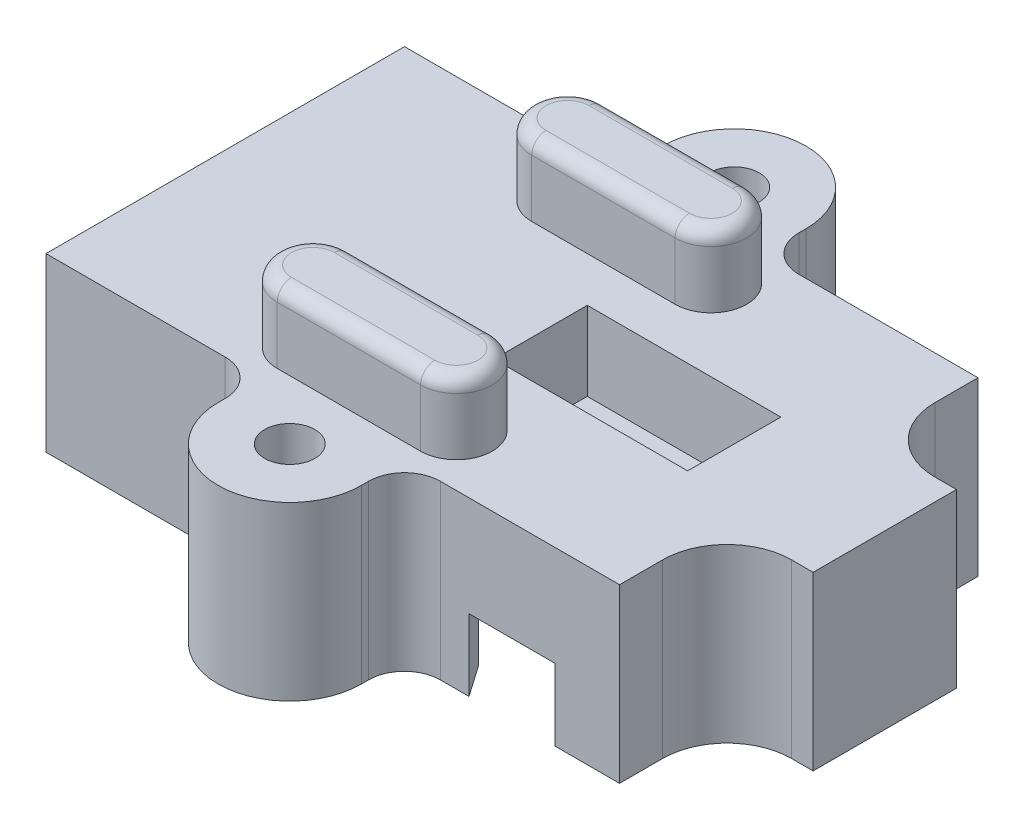
from build123d import *

# Parameters (mm, degrees)
SKETCH2_R           = 1.75
SKETCH2_W           = 13.5
SKETCH2_H           = 3.5
BOSS_EXTRUDE2_DEPTH = 12
BOSS_EXTRUDE3_START = 7
SKETCH2_4_R         = 1.75
SKETCH2_4_W         = 13.5
SKETCH2_4_H         = 6.5
SKETCH2_4_H_2       = 3.5
BOSS_EXTRUDE3_DEPTH = 5
CUT_EXTRUDE1_START  = 12
SKETCH2_6_W         = 13.5
SKETCH2_6_H         = 1.5
CUT_EXTRUDE1_DEPTH  = 5.5
FILLET1_R           = 4.5
CUT_EXTRUDE4_DEPTH  = 5
BOSS_EXTRUDE4_DEPTH = 5
FILLET2_R           = 1


with BuildPart() as part:
    # Sketch2 → Boss-Extrude2 (new body)
    with BuildSketch(Plane(origin=(0, 0, 0), x_dir=(1, 0, 0), z_dir=(0, 1, 0))):
        with BuildLine():
            Line((-20, 12.5), (-20, -12.5))
            Line((-20, -12.5), (-7.5, -12.5))
            ThreePointArc((-7.5, -12.5), (-5.732233047, -13.232233047), (-5, -15))
            Line((-5, -15), (-5, -15.5))
            ThreePointArc((-5, -15.5), (0, -20.5), (5, -15.5))
            Line((5, -15.5), (5, -15))
            ThreePointArc((5, -15), (5.732233047, -13.232233047), (7.5, -12.5))
            Line((7.5, -12.5), (20, -12.5))
            Line((20, -12.5), (20, -5))
            Line((20, -5), (26, -5))
            Line((26, -5), (26, 5))
            Line((26, 5), (20, 5))
            Line((20, 5), (20, 12.5))
            Line((20, 12.5), (7.5, 12.5))
            ThreePointArc((7.5, 12.5), (5.732233047, 13.232233047), (5, 15))
            Line((5, 15), (5, 15.5))
            ThreePointArc((5, 15.5), (0, 20.5), (-5, 15.5))
            Line((-5, 15.5), (-5, 15))
            ThreePointArc((-5, 15), (-5.732233047, 13.232233047), (-7.5, 12.5))
            Line((-7.5, 12.5), (-20, 12.5))
        make_face()
        with Locations(Location((0, -15.5, 0), (0, 0, 270))):
            Circle(SKETCH2_R, mode=Mode.SUBTRACT)
        with Locations(Location((0, 15.5, 0), (0, 0, 270))):
            Circle(SKETCH2_R, mode=Mode.SUBTRACT)
        with Locations((8.75, 0)):
            Rectangle(SKETCH2_W, SKETCH2_H, mode=Mode.SUBTRACT)
    extrude(amount=BOSS_EXTRUDE2_DEPTH)

    # Sketch2<4> → Boss-Extrude3 (add)
    with BuildSketch(Plane(origin=(0, 0, 0), x_dir=(1, 0, 0), z_dir=(0, 1, 0)).offset(BOSS_EXTRUDE3_START)):
        with BuildLine():
            Line((-20, -12.5), (-7.5, -12.5))
            ThreePointArc((-7.5, -12.5), (-5.732233047, -13.232233047), (-5, -15))
            Line((-5, -15), (-5, -15.5))
            ThreePointArc((-5, -15.5), (0, -20.5), (5, -15.5))
            Line((5, -15.5), (5, -15))
            ThreePointArc((5, -15), (5.732233047, -13.232233047), (7.5, -12.5))
            Line((7.5, -12.5), (20, -12.5))
            Line((20, -12.5), (20, -5))
            Line((20, -5), (26, -5))
            Line((26, -5), (26, 5))
            Line((26, 5), (20, 5))
            Line((20, 5), (20, 12.5))
            Line((20, 12.5), (7.5, 12.5))
            ThreePointArc((7.5, 12.5), (5.732233047, 13.232233047), (5, 15))
            Line((5, 15), (5, 15.5))
            ThreePointArc((5, 15.5), (0, 20.5), (-5, 15.5))
            Line((-5, 15.5), (-5, 15))
            ThreePointArc((-5, 15), (-5.732233047, 13.232233047), (-7.5, 12.5))
            Line((-7.5, 12.5), (-20, 12.5))
            Line((-20, 12.5), (-20, -12.5))
        make_face()
        with Locations(Location((0, -15.5, 0), (0, 0, 270))):
            Circle(SKETCH2_4_R, mode=Mode.SUBTRACT)
        with Locations(Location((0, 15.5, 0), (0, 0, 270))):
            Circle(SKETCH2_4_R, mode=Mode.SUBTRACT)
        with Locations((8.75, 0)):
            Rectangle(SKETCH2_4_W, SKETCH2_4_H, mode=Mode.SUBTRACT)
        with Locations((8.75, 0)):
            Rectangle(SKETCH2_4_W, SKETCH2_4_H_2, mode=Mode.SUBTRACT)
    extrude(amount=BOSS_EXTRUDE3_DEPTH)

    # Sketch2<6> → Cut-Extrude1 (cut)
    with BuildSketch(Plane(origin=(0, 0, 0), x_dir=(1, 0, 0), z_dir=(0, 1, 0)).offset(CUT_EXTRUDE1_START)):
        with Locations((8.75, -2.5)):
            Rectangle(SKETCH2_6_W, SKETCH2_6_H)
        with Locations((8.75, 2.5)):
            Rectangle(SKETCH2_6_W, SKETCH2_6_H)
    extrude(amount=-CUT_EXTRUDE1_DEPTH, mode=Mode.SUBTRACT)

    # Fillet1
    fillet1_edges = [part.edges().sort_by_distance(p)[0] for p in [
        (20, 6, -5),
        (20, 6, 5),
    ]]
    fillet(fillet1_edges, radius=FILLET1_R)

    # Sketch3 → Cut-Extrude4 (cut)
    with BuildSketch(Plane.XZ):
        Polygon((7.930232558, 10.25), (2, 1.75), (15.5, 1.75), (15.5, 12.5), (9.5, 12.5), align=None)
        Polygon((2, 10.25), (2, 1.75), (7.930232558, 10.25), align=None)
    extrude(amount=-CUT_EXTRUDE4_DEPTH, mode=Mode.SUBTRACT)

    # Sketch4 → Boss-Extrude4 (add)
    with BuildSketch(Plane(origin=(0, 12, 0), x_dir=(1, 0, 0), z_dir=(0, 1, 0))):
        with BuildLine():
            Line((-5, 11.375), (5, 11.375))
            ThreePointArc((5, 11.375), (7.5, 8.875), (5, 6.375))
            Line((5, 6.375), (-5, 6.375))
            ThreePointArc((-5, 6.375), (-7.5, 8.875), (-5, 11.375))
        make_face()
        with BuildLine():
            Line((-5, -11.375), (5, -11.375))
            ThreePointArc((5, -11.375), (7.5, -8.875), (5, -6.375))
            Line((5, -6.375), (-5, -6.375))
            ThreePointArc((-5, -6.375), (-7.5, -8.875), (-5, -11.375))
        make_face()
    extrude(amount=BOSS_EXTRUDE4_DEPTH)

    # Fillet2
    fillet2_edges = [part.edges().sort_by_distance(p)[0] for p in [
        (-7.5, 17, -8.875),
        (0, 17, -6.375),
        (7.5, 17, -8.875),
        (0, 17, -11.375),
        (-7.5, 17, 8.875),
        (0, 17, 11.375),
        (7.5, 17, 8.875),
        (0, 17, 6.375),
    ]]
    fillet(fillet2_edges, radius=FILLET2_R)


solid = part.part
